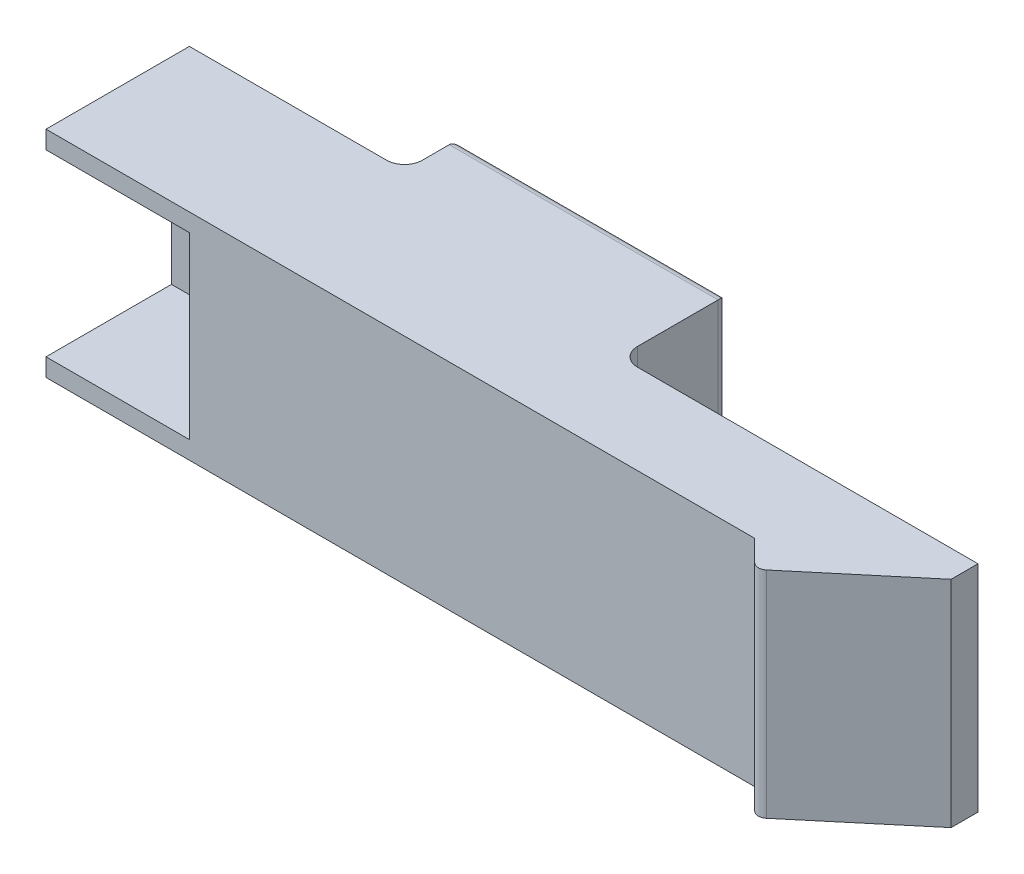
from build123d import *

# Parameters (mm, degrees)
SKETCH_1_W           = 15
SKETCH_1_H           = 12
EXTRUDE_1_DEPTH      = 11
SHELL_1_T            = -2
SKETCH_2_W           = 12
SKETCH_2_H           = 12
EXTRUDE_2_DEPTH      = 8
SKETCH_3_W           = 7
SKETCH_3_H           = 10
CUT_EXTRUDE_1_DEPTH  = 8
FILLET_1_R           = 0.5
SKETCH_4_W           = 5
SKETCH_4_H           = 12
EXTRUDE_3_DEPTH      = 5
EXTRUDE_4_DEPTH      = 6
EXTRUDE_4_DEPTH_BACK = 6
FILLET_2_R           = 1
FILLET_3_R           = 1
FILLET_4_R           = 0.5


with BuildPart() as part:
    # 草图1 → 凸台-拉伸1 (new body)
    with BuildSketch(Plane.XY):
        Rectangle(SKETCH_1_W, SKETCH_1_H)
    extrude(amount=EXTRUDE_1_DEPTH)

    # 抽壳1
    shell_1_openings = [part.faces().sort_by_distance(p)[0] for p in [
        (0, 0, 0),
    ]]
    offset(amount=SHELL_1_T, openings=shell_1_openings, kind=Kind.INTERSECTION)

    # 草图2 → 凸台-拉伸2 (add)
    with BuildSketch(Plane.XY.offset(11)):
        with Locations((-13.5, 0)):
            Rectangle(SKETCH_2_W, SKETCH_2_H)
    extrude(amount=-EXTRUDE_2_DEPTH)

    # 草图3 → 切除-拉伸1 (cut)
    with BuildSketch(Plane.ZY.offset(19.5)):
        with Locations((7.5, 0)):
            Rectangle(SKETCH_3_W, SKETCH_3_H)
    extrude(amount=-CUT_EXTRUDE_1_DEPTH, mode=Mode.SUBTRACT)

    # 圆角1
    fillet_1_edges = [part.edges().sort_by_distance(p)[0] for p in [
        (5.5, 0, 0),
        (0, 4, 0),
        (-5.5, 0, 0),
        (0, -4, 0),
        (0, -6, 0),
        (-7.5, 0, 0),
        (0, 6, 0),
        (7.5, 0, 0),
    ]]
    fillet(fillet_1_edges, radius=FILLET_1_R)

    # 草图4 → 凸台-拉伸3 (add)
    with BuildSketch(Plane.XY.offset(11)):
        with Locations((10, 0)):
            Rectangle(SKETCH_4_W, SKETCH_4_H)
    extrude(amount=-EXTRUDE_3_DEPTH)

    # 草图5 → 凸台-拉伸4 (add, two sides: drawn at the far end of the back side and taken through both)
    with BuildSketch(Plane(origin=(0, 0, 0), x_dir=(1, 0, 0), z_dir=(0, 1, 0)).offset(-EXTRUDE_4_DEPTH_BACK)):
        Polygon((21.541232037, -12.5), (27.5, -7.5), (27.5, -6), (20.041232037, -6), (12.5, -6), (12.5, -11), (20.041232037, -11), align=None)
    extrude(amount=EXTRUDE_4_DEPTH + EXTRUDE_4_DEPTH_BACK)

    # 圆角2
    fillet_2_edges = [part.edges().sort_by_distance(p)[0] for p in [
        (7.5, 0, 6),
    ]]
    fillet(fillet_2_edges, radius=FILLET_2_R)

    # 圆角3
    fillet_3_edges = [part.edges().sort_by_distance(p)[0] for p in [
        (-7.5, 0, 3),
    ]]
    fillet(fillet_3_edges, radius=FILLET_3_R)

    # 圆角4
    fillet_4_edges = [part.edges().sort_by_distance(p)[0] for p in [
        (21.541232037, 0, 12.5),
    ]]
    fillet(fillet_4_edges, radius=FILLET_4_R)


solid = part.part
